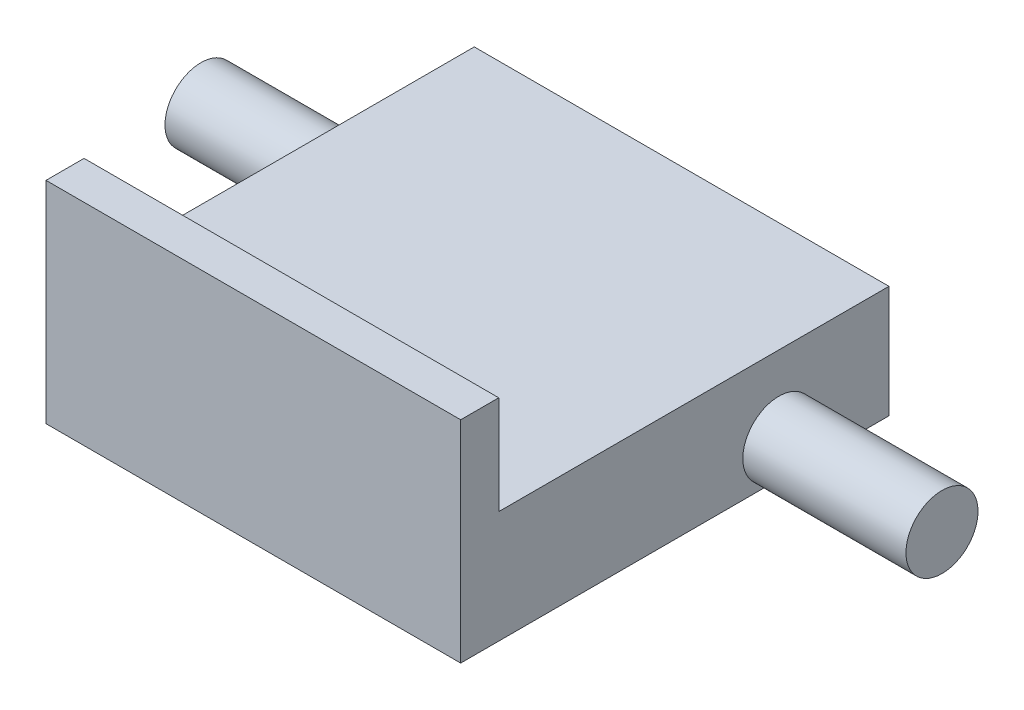
from build123d import *

# Parameters (mm, degrees)
ESQUISSE2_W          = 30.5
ESQUISSE2_H          = 8.25
BASE_EXTRUSION_DEPTH = 31.5
ESQUISSE3_W          = 30.5
ESQUISSE3_H          = 15.5
BOSS_EXTRU_2_DEPTH   = 2.8
ESQUISSE4_R          = 2.65
BOSS_EXTRU_3_DEPTH   = 12


with BuildPart() as part:
    # Esquisse2 → Base-Extrusion (new body)
    with BuildSketch(Plane.XY):
        with Locations((-45.33773679, 19.692248255)):
            Rectangle(ESQUISSE2_W, ESQUISSE2_H)
    extrude(amount=BASE_EXTRUSION_DEPTH)

    # Esquisse3 → Boss.-Extru.2 (add)
    with BuildSketch(Plane.XY.offset(31.5)):
        with Locations((-45.33773679, 23.317248255)):
            Rectangle(ESQUISSE3_W, ESQUISSE3_H)
    extrude(amount=-BOSS_EXTRU_2_DEPTH)

    # Esquisse4 → Boss.-Extru.3 (add)
    with BuildSketch(Plane.ZY.offset(60.58773679)):
        with Locations(Location((8.1, 18.217248255, 0), (0, 0, 270))):
            Circle(ESQUISSE4_R)
    boss_extru_3 = extrude(amount=BOSS_EXTRU_3_DEPTH)

    # Symétrie1: Boss.-Extru.3 across plane
    add(boss_extru_3.mirror(Plane.ZY.offset(45.33773679)))


solid = part.part
